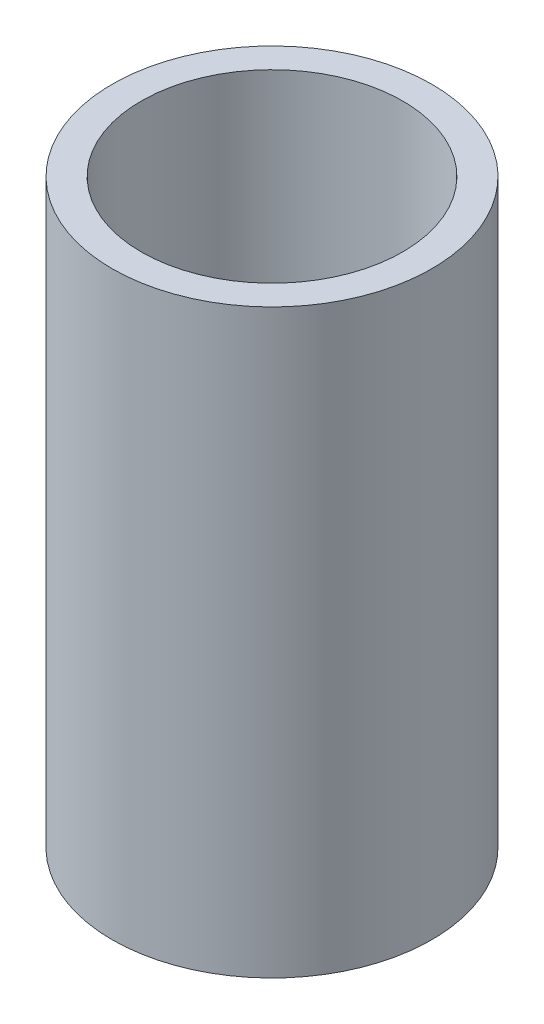
from build123d import *

# Parameters (mm, degrees)
SKETCH1_R           = 2.75
SKETCH1_R_2         = 2.25
BOSS_EXTRUDE1_DEPTH = 10


with BuildPart() as part:
    # Sketch1 → Boss-Extrude1 (new body)
    with BuildSketch(Plane(origin=(0, 0, 0), x_dir=(1, 0, 0), z_dir=(0, 1, 0))):
        with Locations(Location((0, 0, 0), (0, 0, 270))):
            Circle(SKETCH1_R)
        with Locations(Location((0, 0, 0), (0, 0, 270))):
            Circle(SKETCH1_R_2, mode=Mode.SUBTRACT)
    extrude(amount=BOSS_EXTRUDE1_DEPTH)


solid = part.part
